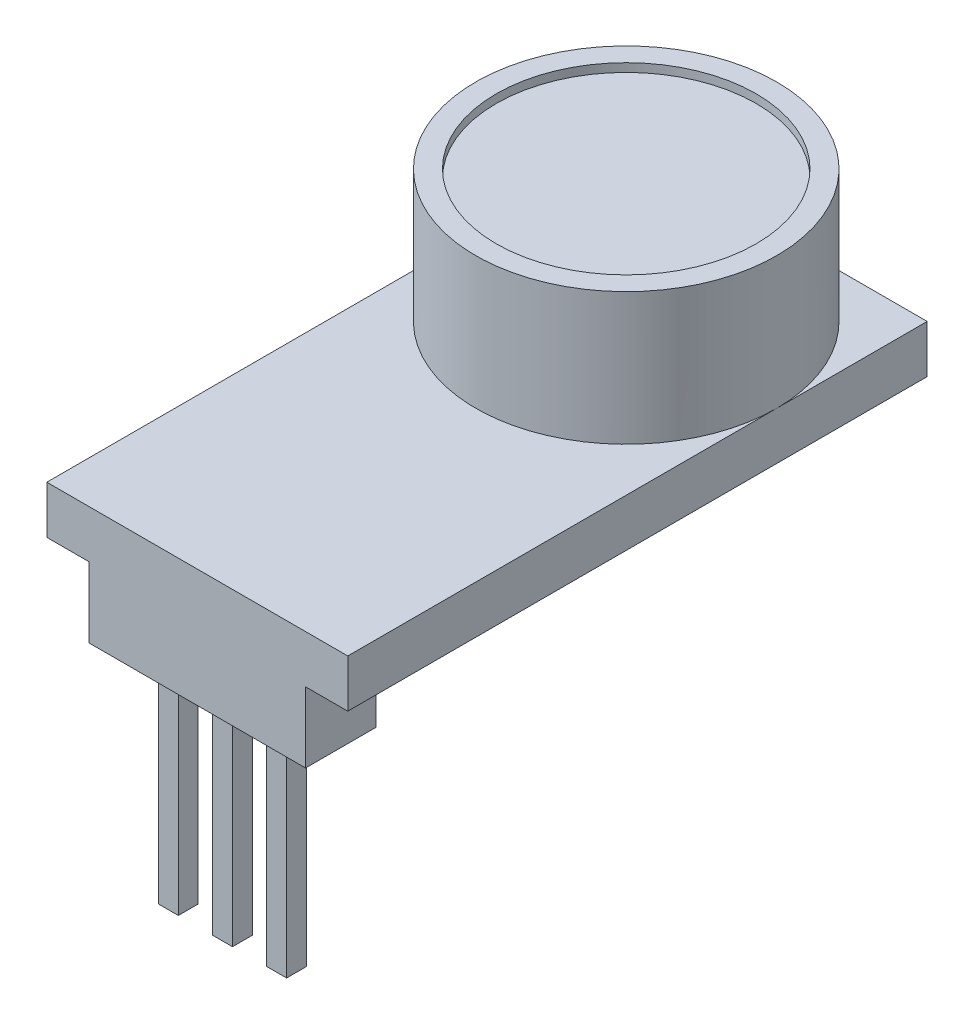
from build123d import *

# Parameters (mm, degrees)
SKETCH1_W           = 10.7
SKETCH1_H           = 20.6
BOSS_EXTRUDE1_DEPTH = 0.85
SKETCH2_R           = 5.35
BOSS_EXTRUDE2_DEPTH = 6.4
SKETCH3_W           = 7.7
SKETCH3_H           = 2.5
BOSS_EXTRUDE3_DEPTH = 2.5
SKETCH4_W           = 0.707106782
SKETCH4_H           = 0.707106782
BOSS_EXTRUDE4_DEPTH = 7.7
SKETCH5_R           = 4.620940101
CUT_EXTRUDE1_DEPTH  = 0.3


with BuildPart() as part:
    # Sketch1 → Boss-Extrude1 (new, symmetric)
    with BuildSketch(Plane(origin=(0, 0, 0), x_dir=(1, 0, 0), z_dir=(0, 1, 0))):
        Rectangle(SKETCH1_W, SKETCH1_H)
    extrude(amount=BOSS_EXTRUDE1_DEPTH, both=True)

    # Sketch2 → Boss-Extrude2 (add)
    with BuildSketch(Plane.XZ.offset(0.85)):
        with Locations(Location((0, -4.95, 0), (0, 0, 270))):
            Circle(SKETCH2_R)
    extrude(amount=-BOSS_EXTRUDE2_DEPTH)

    # Sketch3 → Boss-Extrude3 (add)
    with BuildSketch(Plane.XZ.offset(0.85)):
        with Locations((0, 9.05)):
            Rectangle(SKETCH3_W, SKETCH3_H)
    extrude(amount=BOSS_EXTRUDE3_DEPTH)

    # Sketch4 → Boss-Extrude4 (add)
    with BuildSketch(Plane.XZ.offset(3.35)):
        with Locations((-1.925, 9.05)):
            Rectangle(SKETCH4_W, SKETCH4_H)
        with Locations((0, 9.05)):
            Rectangle(SKETCH4_W, SKETCH4_H)
        with Locations((1.925, 9.05)):
            Rectangle(SKETCH4_W, SKETCH4_H)
    extrude(amount=BOSS_EXTRUDE4_DEPTH)

    # Sketch5 → Cut-Extrude1 (cut)
    with BuildSketch(Plane(origin=(0, 5.55, 0), x_dir=(1, 0, 0), z_dir=(0, 1, 0))):
        with Locations(Location((0, 4.95, 0), (0, 0, 270))):
            Circle(SKETCH5_R)
    extrude(amount=-CUT_EXTRUDE1_DEPTH, mode=Mode.SUBTRACT)


solid = part.part
